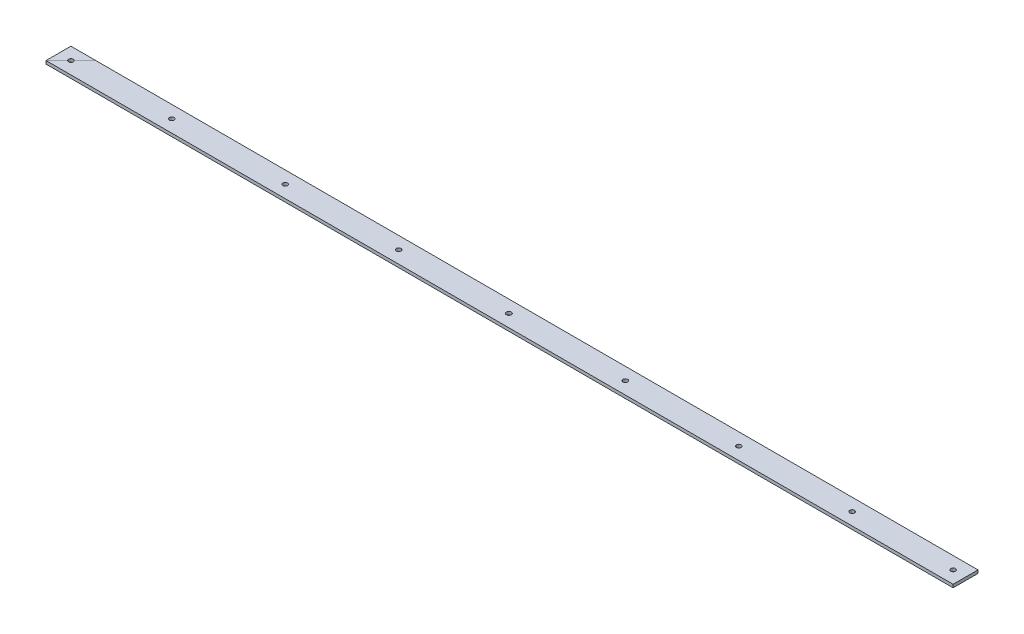
from build123d import *

# Parameters (mm, degrees)
CROQUIS2_W               = 50.8
CROQUIS2_H               = 6.31
CROQUIS3_W               = 50.8
CROQUIS3_H               = 6.31
CROQUIS4_W               = 60
CROQUIS4_H               = 53.155
SALIENTE_EXTRUIR1_DEPTH  = 6.31
CROQUIS5_W               = 60
CROQUIS5_H               = 6.31
CORTAR_EXTRUIR1_DEPTH    = 6.31
CORTAR_EXTRUIR2_DEPTH    = 502
CROQUIS8_W               = 50.8
CROQUIS8_H               = 564.085
CORTAR_EXTRUIR3_DEPTH    = 502
CROQUIS9_W               = 314.3
CROQUIS9_H               = 1090.402933
CORTAR_EXTRUIR4_DEPTH    = 502
CROQUIS10_W              = 50.8
CROQUIS10_H              = 6.31
CORTAR_EXTRUIR5_DEPTH    = 95
CORTAR_EXTRUIR6_DEPTH    = 95
CROQUIS13_W              = 120
CROQUIS13_H              = 249.755
CORTAR_EXTRUIR7_DEPTH    = 95
CROQUIS16_W              = 125
CROQUIS16_H              = 50.8
SALIENTE_EXTRUIR4_DEPTH  = 6.31
CROQUIS17_W              = 50.8
CROQUIS17_H              = 6.31
SALIENTE_EXTRUIR5_DEPTH  = 50.8
SALIENTE_EXTRUIR6_DEPTH  = 50.8
CROQUIS21_W              = 10
CROQUIS21_H              = 50.8
CORTAR_EXTRUIR9_DEPTH    = 53
CROQUIS22_W              = 0.1
CROQUIS22_H              = 50.8
CORTAR_EXTRUIR10_DEPTH   = 10
CORTAR_EXTRUIR11_DEPTH   = 237
CROQUIS24_W              = 50.8
CROQUIS24_H              = 204.986160176
CORTAR_EXTRUIR12_DEPTH   = 237
CROQUIS25_W              = 50.8
CROQUIS25_H              = 6.31
SALIENTE_EXTRUIR7_DEPTH  = 1.1
CROQUIS26_W              = 50.8
CROQUIS26_H              = 6.31
SALIENTE_EXTRUIR8_DEPTH  = 12.7
CROQUIS27_R              = 5
CORTAR_EXTRUIR13_DEPTH   = 10
CROQUIS28_W              = 0.1
CROQUIS28_H              = 50.8
SALIENTE_EXTRUIR9_DEPTH  = 6.31
CROQUIS29_W              = 50.8
CROQUIS29_H              = 0.1
CORTAR_EXTRUIR14_DEPTH   = 50
CROQUIS30_W              = 50.8
CROQUIS30_H              = 6.31
SALIENTE_EXTRUIR10_DEPTH = 50.8
CROQUIS31_R              = 4.7625
CORTAR_EXTRUIR15_DEPTH   = 10
CROQUIS32_R              = 4.7625
CORTAR_EXTRUIR16_DEPTH   = 33
CROQUIS33_R              = 4.7625
CORTAR_EXTRUIR17_DEPTH   = 50
CROQUIS34_R              = 4.7625
CORTAR_EXTRUIR18_DEPTH   = 82
CROQUIS35_R              = 5
CORTAR_EXTRUIR19_DEPTH   = 10
CROQUIS36_W              = 50.8
CROQUIS36_H              = 186.08
CORTAR_EXTRUIR20_DEPTH   = 10


with BuildPart() as part:
    # Barrer1: sweep along a curve in space
    with BuildLine() as barrer1_path:
        Line((0, 0, 0), (0, -567.24, 0))
        Line((0, -567.24, 0), (0, -567.24, 316.2))
        Line((0, -567.24, 316.2), (1793.15, -567.24, 316.2))
        Line((1793.15, -567.24, 316.2), (1793.15, -567.24, 578))
        Line((1793.15, -567.24, 578), (1793.15, -435.47278313, 578))
        Line((1793.15, -435.47278313, 578), (1793.15, -435.47278313, 1432.002933))
    # Croquis2 → Barrer1 (sweep)
    with BuildSketch(Plane(origin=(0, 0, 0), x_dir=(1, 0, 0), z_dir=(0, 1, 0))):
        Rectangle(CROQUIS2_W, CROQUIS2_H)
        with Locations((263.5, 0)):
            Rectangle(CROQUIS2_W, CROQUIS2_H)
    sweep(path=barrer1_path.line, transition=Transition.RIGHT)

    # Barrer4: sweep along a curve in space
    with BuildLine() as barrer4_path:
        Line((-0.201028049, -3.155, -3.155), (-0.201028049, -3.155, -207.155))
        Line((-0.201028049, -3.155, -207.155), (-0.201028049, -53.155, -207.155))
    # Croquis3 → Barrer4 (sweep)
    with BuildSketch(Plane(origin=(0, 0, -3.155), x_dir=(-1, 0, 0), z_dir=(0, 0, -1))):
        with Locations((-263.5, -3.155)):
            Rectangle(CROQUIS3_W, CROQUIS3_H)
        with Locations((0, -3.155)):
            Rectangle(CROQUIS3_W, CROQUIS3_H)
    sweep(path=barrer4_path.line, transition=Transition.RIGHT)

    # Croquis4 → Saliente-Extruir1 (add)
    with BuildSketch(Plane(origin=(0, 0, -210.31), x_dir=(-1, 0, 0), z_dir=(0, 0, -1))):
        with Locations((-208.1, -26.5775)):
            Rectangle(CROQUIS4_W, CROQUIS4_H)
    extrude(amount=-SALIENTE_EXTRUIR1_DEPTH)

    # Croquis5 → Cortar-Extruir1 (cut)
    with BuildSketch(Plane.XY.offset(-204)):
        with Locations((208.1, -3.155)):
            Rectangle(CROQUIS5_W, CROQUIS5_H)
    extrude(amount=-CORTAR_EXTRUIR1_DEPTH, mode=Mode.SUBTRACT)

    # Croquis7 → Cortar-Extruir2 (cut)
    with BuildSketch(Plane.XY.offset(3.155)):
        Polygon((288.9, -564.085), (238.1, -564.085), (238.1, -68.875540851), (170.611072112, -68.875540851), (170.611072112, 0), (288.9, 0), align=None)
    extrude(amount=-CORTAR_EXTRUIR2_DEPTH, mode=Mode.SUBTRACT)

    # Croquis8 → Cortar-Extruir3 (cut)
    with BuildSketch(Plane.XY.offset(3.155)):
        with Locations((0, -282.0425)):
            Rectangle(CROQUIS8_W, CROQUIS8_H)
    extrude(amount=-CORTAR_EXTRUIR3_DEPTH, mode=Mode.SUBTRACT)

    # Croquis9 → Cortar-Extruir4 (cut)
    with BuildSketch(Plane(origin=(0, -432.31778313, 0), x_dir=(1, 0, 0), z_dir=(0, 1, 0))):
        with Locations((1924.9, -886.8014665)):
            Rectangle(CROQUIS9_W, CROQUIS9_H)
    extrude(amount=-CORTAR_EXTRUIR4_DEPTH, mode=Mode.SUBTRACT)

    # Croquis10 → Cortar-Extruir5 (cut)
    with BuildSketch(Plane(origin=(0, 0, -3.155), x_dir=(-1, 0, 0), z_dir=(0, 0, -1))):
        with Locations((0, -567.24)):
            Rectangle(CROQUIS10_W, CROQUIS10_H)
    extrude(amount=-CORTAR_EXTRUIR5_DEPTH, mode=Mode.SUBTRACT)

    # Croquis11 → Cortar-Extruir6 (cut)
    with BuildSketch(Plane(origin=(0, -564.085, 0), x_dir=(1, 0, 0), z_dir=(0, 1, 0))):
        Polygon((238.1, -78.1), (288.9, -78.1), (288.9, -27.3), align=None)
        Polygon((238.1, -78.1), (288.9, -27.3), (238.1, -27.3), align=None)
        Polygon((238.1, -27.3), (288.9, -27.3), (288.9, -3.155), (288.9, 3.155), (238.1, 3.155), (238.1, -3.155), align=None)
    extrude(amount=-CORTAR_EXTRUIR6_DEPTH, mode=Mode.SUBTRACT)

    # Croquis13 → Cortar-Extruir7 (cut)
    with BuildSketch(Plane(origin=(0, -564.085, 0), x_dir=(1, 0, 0), z_dir=(0, 1, 0))):
        with Locations((34.6, -216.7225)):
            Rectangle(CROQUIS13_W, CROQUIS13_H)
    extrude(amount=-CORTAR_EXTRUIR7_DEPTH, mode=Mode.SUBTRACT)

    # Croquis16 → Saliente-Extruir4 (add)
    with BuildSketch(Plane(origin=(0, -564.085, 0), x_dir=(1, 0, 0), z_dir=(0, 1, 0))):
        with Locations((226.4, -52.7)):
            Rectangle(CROQUIS16_W, CROQUIS16_H)
    extrude(amount=-SALIENTE_EXTRUIR4_DEPTH)

    # Barrer5: sweep along a curve in space
    with BuildLine() as barrer5_path:
        Line((94.6, -567.24, 316.2), (46.55, -567.24, 316.2))
        Line((46.55, -567.24, 316.2), (46.55, -567.24, 105.72))
    # Croquis17 → Barrer5 (sweep)
    with BuildSketch(Plane.ZY.offset(-94.6)):
        with Locations((316.2, -567.24)):
            Rectangle(CROQUIS17_W, CROQUIS17_H)
    sweep(path=barrer5_path.line, transition=Transition.RIGHT)

    # Croquis20 → Saliente-Extruir6 (add)
    with BuildSketch(Plane.ZY.offset(-163.9)):
        Polygon((78.1, -564.085), (78.1, -439.884522326), (59.966060883, -387.925515276), (54.008468178, -390.004743297), (71.79, -440.954001003), (71.79, -564.085), align=None)
    extrude(amount=-SALIENTE_EXTRUIR6_DEPTH)

    # Croquis21 → Cortar-Extruir9 (cut)
    with BuildSketch(Plane(origin=(0, -564.085, 0), x_dir=(1, 0, 0), z_dir=(0, 1, 0))):
        with Locations((1813.55, -316.2)):
            Rectangle(CROQUIS21_W, CROQUIS21_H)
    extrude(amount=-CORTAR_EXTRUIR9_DEPTH, mode=Mode.SUBTRACT)

    # Croquis22 → Cortar-Extruir10 (cut)
    with BuildSketch(Plane(origin=(0, -564.085, 0), x_dir=(1, 0, 0), z_dir=(0, 1, 0))):
        with Locations((72, -316.2)):
            Rectangle(CROQUIS22_W, CROQUIS22_H)
    extrude(amount=-CORTAR_EXTRUIR10_DEPTH, mode=Mode.SUBTRACT)

    # Croquis23 → Cortar-Extruir11 (cut)
    with BuildSketch(Plane.XZ.offset(570.395)):
        Polygon((2031.25, 341.6), (2031.25, 78.1), (163.9, 78.1), (163.9, 0), (2111.300371304, 0), (2111.300371304, 341.6), align=None)
    extrude(amount=-CORTAR_EXTRUIR11_DEPTH, mode=Mode.SUBTRACT)

    # Croquis25 → Saliente-Extruir7 (add)
    with BuildSketch(Plane(origin=(0, 0, 105.72), x_dir=(-1, 0, 0), z_dir=(0, 0, -1))):
        with Locations((-46.55, -567.24)):
            Rectangle(CROQUIS25_W, CROQUIS25_H)
    extrude(amount=SALIENTE_EXTRUIR7_DEPTH)

    # Croquis26 → Saliente-Extruir8 (add)
    with BuildSketch(Plane(origin=(1808.55, 0, 0), x_dir=(0, 0, -1), z_dir=(1, 0, 0))):
        with Locations((-316.2, -567.24)):
            Rectangle(CROQUIS26_W, CROQUIS26_H)
    extrude(amount=SALIENTE_EXTRUIR8_DEPTH)

    # Croquis27 → Cortar-Extruir13 (cut)
    with BuildSketch(Plane(origin=(0, -564.085, 0), x_dir=(1, 0, 0), z_dir=(0, 1, 0))):
        with Locations(Location((940.200000079, -316.2, 0), (0, 0, 270))):
            Circle(CROQUIS27_R)
    extrude(amount=-CORTAR_EXTRUIR13_DEPTH, mode=Mode.SUBTRACT)

    # Croquis28 → Saliente-Extruir9 (add)
    with BuildSketch(Plane(origin=(0, -564.085, 0), x_dir=(1, 0, 0), z_dir=(0, 1, 0))):
        with Locations((72, -316.2)):
            Rectangle(CROQUIS28_W, CROQUIS28_H)
    extrude(amount=-SALIENTE_EXTRUIR9_DEPTH)

    # Croquis29 → Cortar-Extruir14 (cut)
    with BuildSketch(Plane(origin=(0, -564.085, 0), x_dir=(1, 0, 0), z_dir=(0, 1, 0))):
        with Locations((46.55, -290.75)):
            Rectangle(CROQUIS29_W, CROQUIS29_H)
    extrude(amount=-CORTAR_EXTRUIR14_DEPTH, mode=Mode.SUBTRACT)


with BuildPart() as body_2:
    # Croquis18 → Saliente-Extruir5 (new body)
    with BuildSketch(Plane.ZY.offset(-21.15)):
        Polygon((98.787204793, -564.085), (98.787204793, -435.522965931), (64.969988324, -367.622744457), (59.321737777, -370.435814978), (91.897545374, -435.843461779), (91.842933, -564.085), align=None)
    extrude(amount=-SALIENTE_EXTRUIR5_DEPTH)

    # Croquis24 → Cortar-Extruir12 (cut)
    with BuildSketch(Plane.XY.offset(98.787204793)):
        with Locations((46.55, -461.591919912)):
            Rectangle(CROQUIS24_W, CROQUIS24_H)
    extrude(amount=-CORTAR_EXTRUIR12_DEPTH, mode=Mode.SUBTRACT)


with BuildPart() as cortar_extruir14_piece_1:
    # of the separate pieces the step leaves, piece 1, a body of its own (cortar_extruir14_pieces)
    add(part.part.solids().sort_by_distance((1821.25, -570.395, 341.6))[0])

    # Croquis30 → Saliente-Extruir10 (add)
    with BuildSketch(Plane(origin=(1821.25, 0, 0), x_dir=(0, 0, -1), z_dir=(1, 0, 0))):
        with Locations((-316.2, -567.24)):
            Rectangle(CROQUIS30_W, CROQUIS30_H)
    extrude(amount=SALIENTE_EXTRUIR10_DEPTH)

    # Croquis31 → Cortar-Extruir15 (cut)
    with BuildSketch(Plane(origin=(0, -564.085, 0), x_dir=(1, 0, 0), z_dir=(0, 1, 0))):
        with Locations(Location((1846.65, -316.2, 0), (0, 0, 270))):
            Circle(CROQUIS31_R)
    extrude(amount=-CORTAR_EXTRUIR15_DEPTH, mode=Mode.SUBTRACT)

    # Croquis32 → Cortar-Extruir16 (cut)
    with BuildSketch(Plane(origin=(0, -564.085, 0), x_dir=(1, 0, 0), z_dir=(0, 1, 0))):
        with Locations(Location((46.55, -316.2, 0), (0, 0, 225))):
            Circle(CROQUIS32_R)
    extrude(amount=-CORTAR_EXTRUIR16_DEPTH, mode=Mode.SUBTRACT)

    # Croquis34 → Cortar-Extruir18 (cut)
    with BuildSketch(Plane(origin=(0, -564.085, 0), x_dir=(1, 0, 0), z_dir=(0, 1, 0))):
        with Locations(Location((1640.6875, -316.2, 0), (0, 0, 270))):
            Circle(CROQUIS34_R)
        with Locations(Location((1409.325, -316.2, 0), (0, 0, 270))):
            Circle(CROQUIS34_R)
        with Locations(Location((1177.9625, -316.2, 0), (0, 0, 270))):
            Circle(CROQUIS34_R)
        with Locations(Location((715.2375, -316.2, 0), (0, 0, 270))):
            Circle(CROQUIS34_R)
        with Locations(Location((483.875, -316.2, 0), (0, 0, 270))):
            Circle(CROQUIS34_R)
        with Locations(Location((252.5125, -316.2, 0), (0, 0, 270))):
            Circle(CROQUIS34_R)
    extrude(amount=-CORTAR_EXTRUIR18_DEPTH, mode=Mode.SUBTRACT)


with BuildPart() as cortar_extruir14_piece_2:
    # of the separate pieces the step leaves, piece 2, a body of its own (cortar_extruir14_pieces)
    add(part.part.solids().sort_by_distance((21.15, -570.395, 290.7))[0])

    # Croquis33 → Cortar-Extruir17 (cut)
    with BuildSketch(Plane(origin=(0, -570.395, 0), x_dir=(-1, 0, 0), z_dir=(0, -1, 0))):
        with Locations(Location((-33.85, -252.7, 0), (0, 0, 90))):
            Circle(CROQUIS33_R)
        with Locations(Location((-59.25, -278.1, 0), (0, 0, 90))):
            Circle(CROQUIS33_R)
    extrude(amount=-CORTAR_EXTRUIR17_DEPTH, mode=Mode.SUBTRACT)

    # Croquis35 → Cortar-Extruir19 (cut)
    with BuildSketch(Plane(origin=(0, -564.085, 0), x_dir=(1, 0, 0), z_dir=(0, 1, 0))):
        with Locations(Location((46.552050791, -160.802067, 0), (0, 0, 270))):
            Circle(CROQUIS35_R)
    extrude(amount=-CORTAR_EXTRUIR19_DEPTH, mode=Mode.SUBTRACT)

    # Croquis36 → Cortar-Extruir20 (cut)
    with BuildSketch(Plane(origin=(0, -564.085, 0), x_dir=(1, 0, 0), z_dir=(0, 1, 0))):
        with Locations((46.55, -197.66)):
            Rectangle(CROQUIS36_W, CROQUIS36_H)
    extrude(amount=-CORTAR_EXTRUIR20_DEPTH, mode=Mode.SUBTRACT)


solid = cortar_extruir14_piece_1.part
